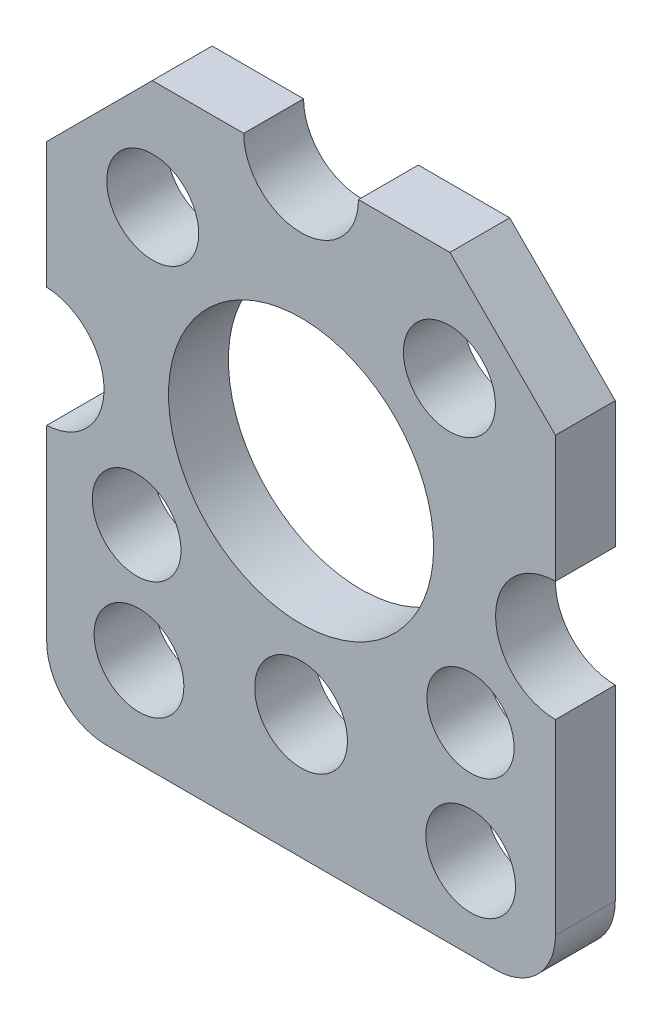
from build123d import *

# Parameters (mm, degrees)
SKETCH1_W           = 21.59
SKETCH1_H           = 25.4
BOSS_EXTRUDE1_DEPTH = 2.54
FILLET1_R           = 2.54
CUT_EXTRUDE1_DEPTH  = 30.115049214
SKETCH3_R           = 5.625489831
SKETCH3_R_2         = 2.54
SKETCH3_R_3         = 2.540453657
SKETCH3_R_4         = 1.951297309
SKETCH3_R_5         = 2.434341389
SKETCH3_R_6         = 1.968933299
SKETCH3_R_7         = 1.905
CUT_EXTRUDE2_DEPTH  = 30.115049214
SKETCH4_R           = 1.851487323
SKETCH4_R_2         = 1.882954115
CUT_EXTRUDE3_DEPTH  = 30.115049214


with BuildPart() as part:
    # Sketch1 → Boss-Extrude1 (new body)
    with BuildSketch(Plane.XY):
        with Locations((-12.398804361, 4.71499153)):
            Rectangle(SKETCH1_W, SKETCH1_H)
    extrude(amount=BOSS_EXTRUDE1_DEPTH)

    # Fillet1
    fillet1_edges = [part.edges().sort_by_distance(p)[0] for p in [
        (-23.193804361, -7.98500847, 1.27),
        (-1.603804361, -7.98500847, 1.27),
    ]]
    fillet(fillet1_edges, radius=FILLET1_R)

    # Sketch2 → Cut-Extrude1 (cut, through all)
    with BuildSketch(Plane.XY.offset(2.54)):
        Polygon((-24.267164586, 11.861079729), (-17.410801404, 18.717442911), (-24.267164586, 18.717442911), align=None)
        Polygon((-7.386807318, 18.717442911), (-0.530444135, 18.717442911), (-0.530444135, 11.861079729), align=None)
    extrude(amount=-CUT_EXTRUDE1_DEPTH, mode=Mode.SUBTRACT)

    # Sketch3 → Cut-Extrude2 (cut, through all)
    with BuildSketch(Plane.XY.offset(2.54)):
        with Locations((-12.398804361, 6.226040262)):
            Circle(SKETCH3_R)
        with Locations((-23.301730566, 5.040576616)):
            Circle(SKETCH3_R_2)
        with Locations((-1.603804361, 5.023879945)):
            Circle(SKETCH3_R_3)
        with Locations((-18.693449352, 12.771135319)):
            Circle(SKETCH3_R_4)
        with Locations((-12.398804361, 17.41499153)):
            Circle(SKETCH3_R_5)
        with Locations(Location((-6.104159369, 12.771135319, 0), (0, 0, 180))):
            Circle(SKETCH3_R_4)
        with Locations((-12.398804361, -2.723375429)):
            Circle(SKETCH3_R_6)
        with Locations((-19.27783284, -4.174711925)):
            Circle(SKETCH3_R_7)
        with Locations((-5.202539132, -4.508645347)):
            Circle(SKETCH3_R_7)
    extrude(amount=-CUT_EXTRUDE2_DEPTH, mode=Mode.SUBTRACT)

    # Sketch4 → Cut-Extrude3 (cut, through all)
    with BuildSketch(Plane.XY.offset(2.54)):
        with Locations((-5.209017976, 0.565757183)):
            Circle(SKETCH4_R)
        with Locations((-19.377050407, 0.75613176)):
            Circle(SKETCH4_R_2)
    extrude(amount=-CUT_EXTRUDE3_DEPTH, mode=Mode.SUBTRACT)


solid = part.part
